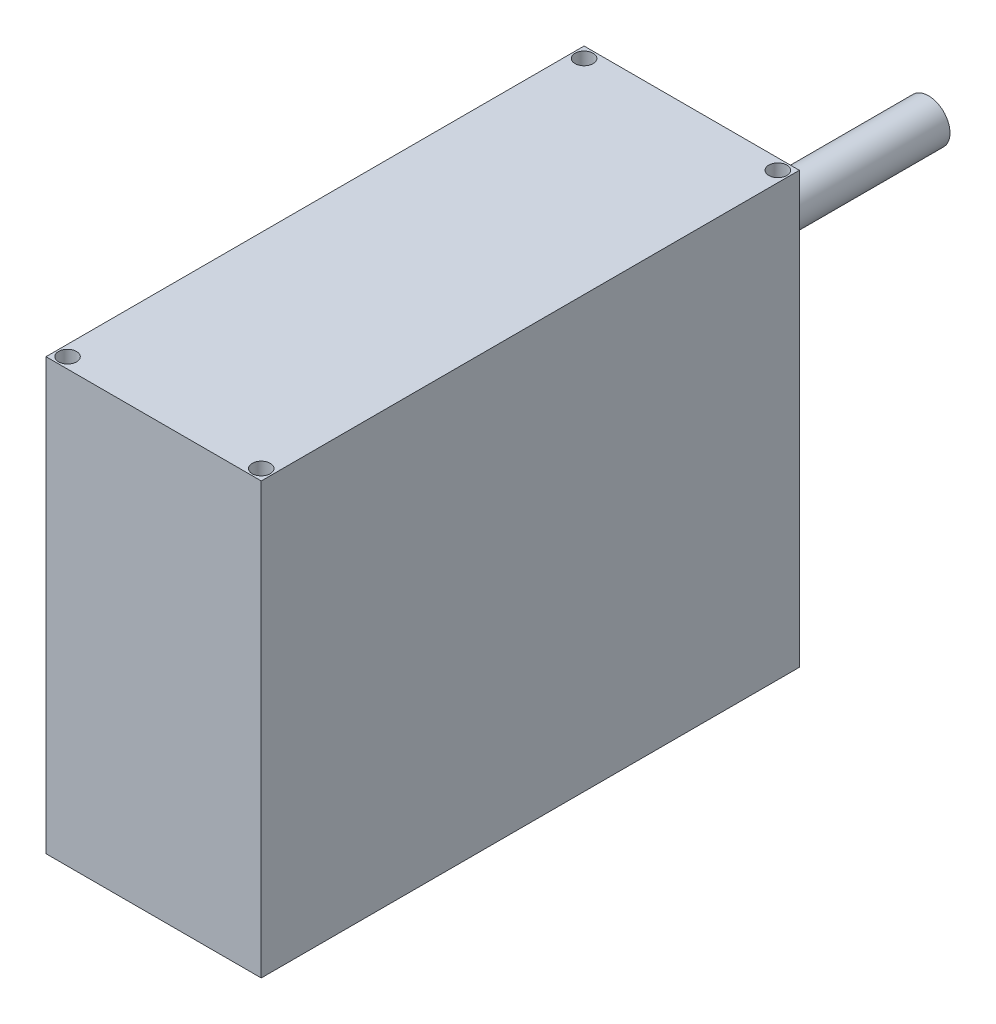
from build123d import *

# Parameters (mm, degrees)
SKETCH1_W           = 50
SKETCH1_H           = 100
BOSS_EXTRUDE1_DEPTH = 125
SKETCH2_R           = 5
BOSS_EXTRUDE2_DEPTH = 55
SKETCH3_R           = 2.1
CUT_EXTRUDE1_DEPTH  = 6
SKETCH4_R           = 3.2
CUT_EXTRUDE2_DEPTH  = 10


with BuildPart() as part:
    # Sketch1 → Boss-Extrude1 (new body)
    with BuildSketch(Plane.XY):
        Rectangle(SKETCH1_W, SKETCH1_H)
    extrude(amount=BOSS_EXTRUDE1_DEPTH)

    # Sketch2 → Boss-Extrude2 (add)
    with BuildSketch(Plane.XY):
        with Locations((0, 20)):
            Circle(SKETCH2_R)
    extrude(amount=-BOSS_EXTRUDE2_DEPTH)

    # Sketch3 → Cut-Extrude1 (cut)
    with BuildSketch(Plane(origin=(0, 50, 0), x_dir=(1, 0, 0), z_dir=(0, 1, 0))):
        with Locations(Location((-22.5, -2.5, 0), (0, 0, 270))):
            Circle(SKETCH3_R)
        with Locations(Location((22.5, -2.5, 0), (0, 0, 270))):
            Circle(SKETCH3_R)
        with Locations(Location((22.5, -122.5, 0), (0, 0, 270))):
            Circle(SKETCH3_R)
        with Locations(Location((-22.5, -122.5, 0), (0, 0, 270))):
            Circle(SKETCH3_R)
    extrude(amount=-CUT_EXTRUDE1_DEPTH, mode=Mode.SUBTRACT)

    # Sketch4 → Cut-Extrude2 (cut)
    with BuildSketch(Plane(origin=(0, 0, -55), x_dir=(-1, 0, 0), z_dir=(0, 0, -1))):
        with Locations((0, 20)):
            Circle(SKETCH4_R)
    extrude(amount=-CUT_EXTRUDE2_DEPTH, mode=Mode.SUBTRACT)


solid = part.part
